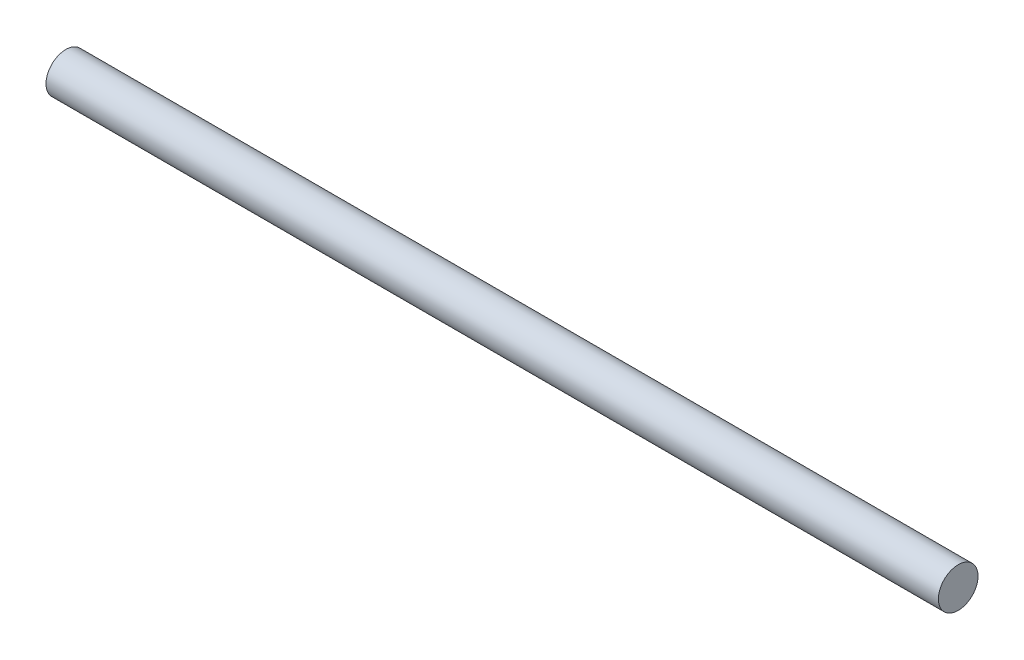
from build123d import *

# Parameters (mm, degrees)
SKETCH_1_W = 90
SKETCH_1_H = 2


with BuildPart() as part:
    # 草图1 → 旋转1 (revolve)
    with BuildSketch(Plane(origin=(0, 0, 5), x_dir=(-1, 0, 0), z_dir=(0, 0, -1)), mode=Mode.PRIVATE) as revolve_1_sk:
        with Locations((0, -74)):
            Rectangle(SKETCH_1_W, SKETCH_1_H)
    revolve(revolve_1_sk.sketch.rotate(Axis((45, -75, 5), (-1, 0, 0)), 270), axis=Axis((45, -75, 5), (-1, 0, 0)))


solid = part.part
